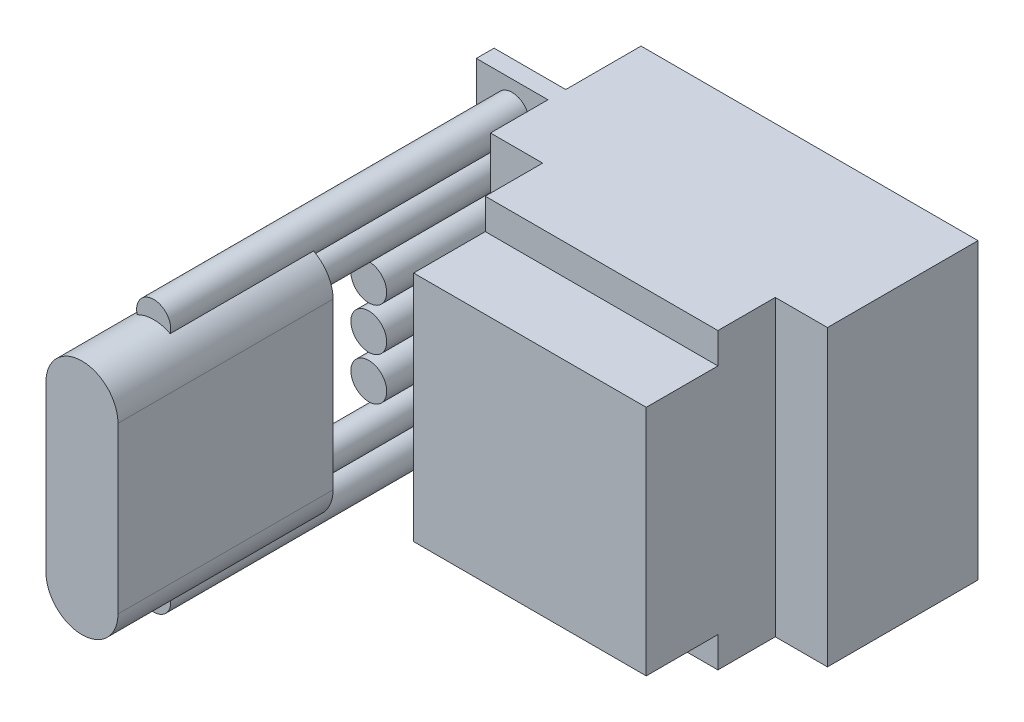
from build123d import *

# Parameters (mm, degrees)
SKETCH_1_W          = 47
SKETCH_1_H          = 41
EXTRUDE_1_DEPTH     = 29
SKETCH_2_W          = 7.275664065
SKETCH_2_H          = 41
CUT_EXTRUDE_1_DEPTH = 8
SKETCH_3_W          = 32.44867187
SKETCH_3_H          = 32.44867187
EXTRUDE_2_DEPTH     = 10
SKETCH_4_W          = 2.477658442
SKETCH_4_H          = 41
EXTRUDE_3_DEPTH     = 10
SKETCH_5_R          = 2.381517546
EXTRUDE_4_DEPTH     = 50
SKETCH_6_R          = 2.5
EXTRUDE_5_DEPTH     = 20
SKETCH_7_R          = 2.218731485
SKETCH_7_R_2        = 2.107008454
EXTRUDE_6_DEPTH     = 30
EXTRUDE_7_DEPTH     = 30


with BuildPart() as part:
    # Эскиз1 → Бобышка-Вытянуть1 (new body)
    with BuildSketch(Plane.XY):
        Rectangle(SKETCH_1_W, SKETCH_1_H)
    extrude(amount=EXTRUDE_1_DEPTH)

    # Эскиз2 → Вырез-Вытянуть1 (cut)
    with BuildSketch(Plane.XY.offset(29)):
        with Locations((-19.862167967, 0)):
            Rectangle(SKETCH_2_W, SKETCH_2_H)
        with Locations((19.862167967, 0)):
            Rectangle(SKETCH_2_W, SKETCH_2_H)
    extrude(amount=-CUT_EXTRUDE_1_DEPTH, mode=Mode.SUBTRACT)

    # Эскиз3 → Бобышка-Вытянуть2 (add)
    with BuildSketch(Plane.XY.offset(29)):
        Rectangle(SKETCH_3_W, SKETCH_3_H)
    extrude(amount=EXTRUDE_2_DEPTH)

    # Эскиз4 → Бобышка-Вытянуть3 (add)
    with BuildSketch(Plane.ZY.offset(23.5)):
        with Locations((11.738829221, 0)):
            Rectangle(SKETCH_4_W, SKETCH_4_H)
    extrude(amount=EXTRUDE_3_DEPTH)

    # Эскиз5 → Бобышка-Вытянуть4 (add)
    with BuildSketch(Plane.XY.offset(12.977658442)):
        with Locations(Location((-28.5, 16.509831399, 0), (0, 0, 180))):
            Circle(SKETCH_5_R)
        with Locations(Location((-28.5, -16.509831399, 0), (0, 0, 180))):
            Circle(SKETCH_5_R)
    extrude(amount=EXTRUDE_4_DEPTH)

    # Эскиз6 → Бобышка-Вытянуть5 (add)
    with BuildSketch(Plane.XY.offset(12.977658442)):
        with Locations(Location((-28.5, 5.969771762, 0), (0, 0, 180))):
            Circle(SKETCH_6_R)
        with Locations(Location((-28.5, 0, 0), (0, 0, 180))):
            Circle(SKETCH_6_R)
        with Locations(Location((-28.5, -5.977057546, 0), (0, 0, 180))):
            Circle(SKETCH_6_R)
    extrude(amount=EXTRUDE_5_DEPTH)

    # Эскиз7 → Бобышка-Вытянуть6 (add)
    with BuildSketch(Plane.XY.offset(12.977658442)):
        with Locations(Location((-28.5, 11.429883276, 0), (0, 0, 180))):
            Circle(SKETCH_7_R)
        with Locations(Location((-28.5, -11.605053901, 0), (0, 0, 180))):
            Circle(SKETCH_7_R_2)
    extrude(amount=EXTRUDE_6_DEPTH)

    # Эскиз8 → Бобышка-Вытянуть7 (add)
    with BuildSketch(Plane.XY.offset(42.977658442)):
        with BuildLine():
            Line((-23.480513429, 11.429883276), (-23.480513429, -11.605053901))
            ThreePointArc((-23.480513429, -11.605053901), (-28.5, -16.624540472), (-33.519486571, -11.605053901))
            Line((-33.519486571, -11.605053901), (-33.519486571, 11.429883276))
            ThreePointArc((-33.519486571, 11.429883276), (-28.5, 16.449369847), (-23.480513429, 11.429883276))
        make_face()
    extrude(amount=EXTRUDE_7_DEPTH)


solid = part.part
